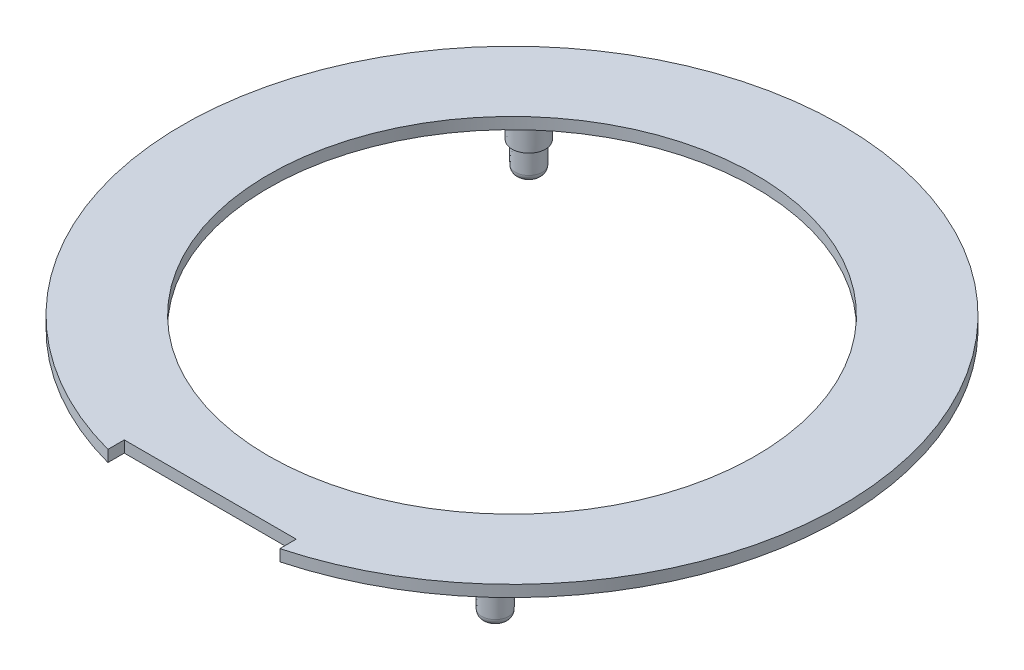
from build123d import *

# Parameters (mm, degrees)
SKETCH1_R           = 11.5
SKETCH1_R_2         = 8.5
BOSS_EXTRUDE1_DEPTH = 0.4
SKETCH2_R           = 0.6
BOSS_EXTRUDE2_DEPTH = 1
SKETCH3_R           = 0.5
BOSS_EXTRUDE3_DEPTH = 1
CIRPATTERN1_COUNT   = 4
DRAFT1_ANGLE        = 1
FILLET1_R           = 0.25
CUT_EXTRUDE1_START  = -0.4
CUT_EXTRUDE1_DEPTH  = 0.4


with BuildPart() as part:
    # Sketch1 → Boss-Extrude1 (new body)
    with BuildSketch(Plane(origin=(0, 0, 0), x_dir=(1, 0, 0), z_dir=(0, 1, 0))):
        with Locations(Location((0, 1.53064501, 0), (0, 0, 270))):
            Circle(SKETCH1_R)
        with Locations(Location((0, 1.53064501, 0), (0, 0, 270))):
            Circle(SKETCH1_R_2, mode=Mode.SUBTRACT)
    extrude(amount=BOSS_EXTRUDE1_DEPTH)

    # Sketch2 → Boss-Extrude2 (add)
    with BuildSketch(Plane(origin=(0, 0, 0), x_dir=(1, 0, 0), z_dir=(0, 1, 0))):
        with Locations(Location((-7.0041347, -4.887461962, 0), (0, 0, 270))):
            Circle(SKETCH2_R)
    boss_extrude2 = extrude(amount=-BOSS_EXTRUDE2_DEPTH)

    # Sketch3 → Boss-Extrude3 (add)
    with BuildSketch(Plane.XZ.offset(1)):
        with Locations(Location((-7.0041347, 4.887461962, 0), (0, 0, 270))):
            Circle(SKETCH3_R)
    boss_extrude3 = extrude(amount=BOSS_EXTRUDE3_DEPTH)

    # CirPattern1: Boss-Extrude2, Boss-Extrude3 ×4 about axis
    cirpattern1_axis = Axis((0, 0, -1.53064501), (0, 1, 0))
    add([boss_extrude2.rotate(cirpattern1_axis, i * 360 / CIRPATTERN1_COUNT) for i in range(1, CIRPATTERN1_COUNT)])
    add([boss_extrude3.rotate(cirpattern1_axis, i * 360 / CIRPATTERN1_COUNT) for i in range(1, CIRPATTERN1_COUNT)])

    # Draft1
    draft1_faces = [part.faces().sort_by_distance(p)[0] for p in [
        (5.818106972, -0.5, 5.47348969),
        (6.918106972, -1.5, 5.47348969),
        (7.0041347, -0.5, -7.348751982),
        (7.0041347, -1.5, -8.448751982),
        (-5.818106972, -0.5, -8.53477971),
        (-6.918106972, -1.5, -8.53477971),
        (-7.0041347, -0.5, 4.287461962),
        (-7.0041347, -1.5, 5.387461962),
    ]]
    draft(draft1_faces, Plane(origin=(0, 0, -1.53064501), x_dir=(0, 0, -1), z_dir=(0, -1, 0)), DRAFT1_ANGLE)

    # Fillet1
    fillet1_edges = [part.edges().sort_by_distance(p)[0] for p in [
        (-7.0041347, -2, 5.352551832),
        (-6.883196842, -2, -8.53477971),
        (7.0041347, -2, -8.413841852),
        (6.883196842, -2, 5.47348969),
    ]]
    fillet(fillet1_edges, radius=FILLET1_R)

    # Sketch6 → Cut-Extrude1 (cut)
    with BuildSketch(Plane(origin=(0, 0.4, 0), x_dir=(1, 0, 0), z_dir=(0, 1, 0)).offset(CUT_EXTRUDE1_START)):
        with BuildLine():
            Line((3, -9), (-3, -9))
            Line((-3, -9), (-3, -9.571156646))
            ThreePointArc((-3, -9.571156646), (0, -9.96935499), (3, -9.571156646))
            Line((3, -9.571156646), (3, -9))
        make_face()
    extrude(amount=CUT_EXTRUDE1_DEPTH, mode=Mode.SUBTRACT)


solid = part.part
